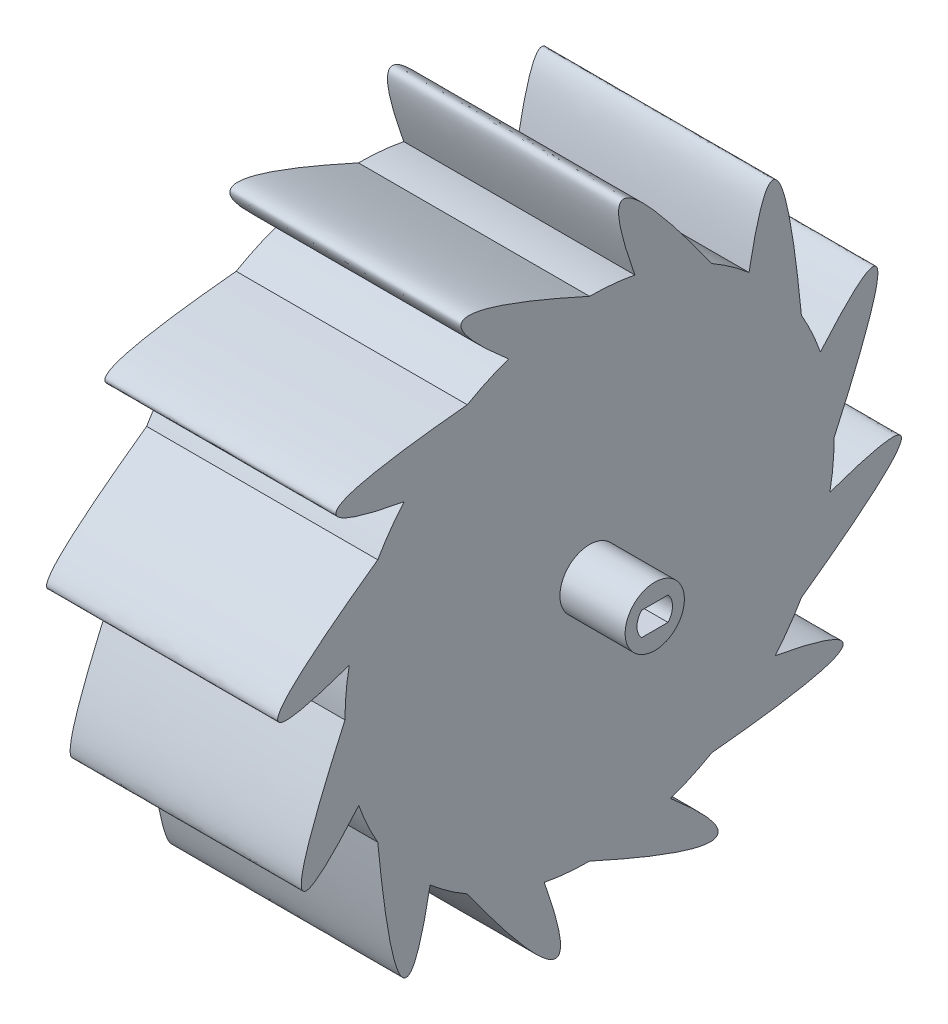
from build123d import *

# Parameters (mm, degrees)
SKETCH1_R           = 32.5
SKETCH1_R_2         = 5
BOSS_EXTRUDE1_DEPTH = 35
SKETCH2_R           = 8.5
SKETCH2_R_2         = 1
BOSS_EXTRUDE2_DEPTH = 1
SKETCH3_R           = 32.5
BOSS_EXTRUDE4_DEPTH = 2
SKETCH4_R           = 32.5
SKETCH4_R_2         = 5
BOSS_EXTRUDE5_DEPTH = 2
SKETCH5_R           = 5
BOSS_EXTRUDE6_DEPTH = 48
BOSS_EXTRUDE7_START = -39
SKETCH6_R           = 32.5
BOSS_EXTRUDE7_DEPTH = 39


with BuildPart() as part:
    # Sketch1 → Boss-Extrude1 (new body)
    with BuildSketch(Plane(origin=(0, 0, 0), x_dir=(0, 0, -1), z_dir=(1, 0, 0))):
        Circle(SKETCH1_R)
        Circle(SKETCH1_R_2, mode=Mode.SUBTRACT)
    extrude(amount=-BOSS_EXTRUDE1_DEPTH)



with BuildPart() as body_2:
    # Sketch2 → Boss-Extrude2 (new body)
    with BuildSketch(Plane.ZY.offset(35)):
        Circle(SKETCH2_R)
        Circle(SKETCH2_R_2, mode=Mode.SUBTRACT)
    extrude(amount=-BOSS_EXTRUDE2_DEPTH)


with BuildPart() as part_1:
    add(part.part)

    add(body_2.part)  # Boss-Extrude4 merges body 2
    # Sketch3 → Boss-Extrude4 (add)
    with BuildSketch(Plane.ZY.offset(35)):
        with Locations(Location((0, 0, 0), (0, 0, 180))):
            Circle(SKETCH3_R)
        with BuildLine():
            Line((12.893796958, 4), (20.615528128, 4))
            ThreePointArc((20.615528128, 4), (21, 0), (20.615528128, -4))
            Line((20.615528128, -4), (12.893796958, -4))
            ThreePointArc((12.893796958, -4), (13.5, 0), (12.893796958, 4))
        make_face(mode=Mode.SUBTRACT)
        with BuildLine():
            Line((7.788628447, -11.026661639), (10.174774605, -18.370464386))
            ThreePointArc((10.174774605, -18.370464386), (6.489356882, -19.972186842), (2.566322474, -20.842600341))
            Line((2.566322474, -20.842600341), (0.180176317, -13.498797594))
            ThreePointArc((0.180176317, -13.498797594), (4.171729424, -12.83926297), (7.788628447, -11.026661639))
        make_face(mode=Mode.SUBTRACT)
        with BuildLine():
            Line((-8.080159852, -10.814851676), (-14.327171594, -15.353571379))
            ThreePointArc((-14.327171594, -15.353571379), (-16.989356882, -12.343490298), (-19.029453613, -8.881435424))
            Line((-19.029453613, -8.881435424), (-12.78244187, -4.342715721))
            ThreePointArc((-12.78244187, -4.342715721), (-10.921729424, -7.935100906), (-8.080159852, -10.814851676))
        make_face(mode=Mode.SUBTRACT)
        with BuildLine():
            Line((-12.78244187, 4.342715721), (-19.029453613, 8.881435424))
            ThreePointArc((-19.029453613, 8.881435424), (-16.989356882, 12.343490298), (-14.327171594, 15.353571379))
            Line((-14.327171594, 15.353571379), (-8.080159852, 10.814851676))
            ThreePointArc((-8.080159852, 10.814851676), (-10.921729424, 7.935100906), (-12.78244187, 4.342715721))
        make_face(mode=Mode.SUBTRACT)
        with BuildLine():
            Line((0.180176317, 13.498797594), (2.566322474, 20.842600341))
            ThreePointArc((2.566322474, 20.842600341), (6.489356882, 19.972186842), (10.174774605, 18.370464386))
            Line((10.174774605, 18.370464386), (7.788628447, 11.026661639))
            ThreePointArc((7.788628447, 11.026661639), (4.171729424, 12.83926297), (0.180176317, 13.498797594))
        make_face(mode=Mode.SUBTRACT)
        with BuildLine():
            Line((-2.236067977, 2), (2.236067977, 2))
            ThreePointArc((2.236067977, 2), (3, 0), (2.236067977, -2))
            Line((2.236067977, -2), (-2.236067977, -2))
            ThreePointArc((-2.236067977, -2), (-3, 0), (-2.236067977, 2))
        make_face(mode=Mode.SUBTRACT)
    extrude(amount=BOSS_EXTRUDE4_DEPTH)

    # Sketch4 → Boss-Extrude5 (add)
    with BuildSketch(Plane.ZY.offset(37)):
        with Locations(Location((0, 0, 0), (0, 0, 180))):
            Circle(SKETCH4_R)
        with Locations(Location((0, 0, 0), (0, 0, 180))):
            Circle(SKETCH4_R_2, mode=Mode.SUBTRACT)
    extrude(amount=BOSS_EXTRUDE5_DEPTH)



with BuildPart() as body_2_2:
    # Sketch5 → Boss-Extrude6 (new body)
    with BuildSketch(Plane.ZY.offset(37)):
        with Locations(Location((0, 0, 0), (0, 0, 180))):
            Circle(SKETCH5_R)
        with BuildLine():
            Line((2.236067977, 2), (-2.236067977, 2))
            ThreePointArc((-2.236067977, 2), (-3, 0), (-2.236067977, -2))
            Line((-2.236067977, -2), (2.236067977, -2))
            ThreePointArc((2.236067977, -2), (3, 0), (2.236067977, 2))
        make_face(mode=Mode.SUBTRACT)
    extrude(amount=-BOSS_EXTRUDE6_DEPTH)


with BuildPart() as part_2:
    add(part_1.part)

    add(body_2_2.part)  # Boss-Extrude7 merges body 2 2
    # Sketch6 → Boss-Extrude7 (add)
    with BuildSketch(Plane.ZY.offset(39).offset(BOSS_EXTRUDE7_START)):
        with BuildLine():
            ThreePointArc((-20.63586518, 35.74236695), (-23.870874178, 33.668042606), (-26.898922548, 31.301816125))
            add(Edge.make_bspline(
                [(-35.74236695, 20.63586518), (-31.995057853, 58.772650811), (-26.898922548, 31.301816125)],
                knots=[0, 0, 0, 1, 1, 1], degree=2))
            ThreePointArc((-35.74236695, 20.63586518), (-37.506804752, 17.221943104), (-38.946058323, 13.658706674))
            add(Edge.make_bspline(
                [(-41.27173036, 0), (-57.094858301, 34.901079724), (-38.946058323, 13.658706674)],
                knots=[0, 0, 0, 1, 1, 1], degree=2))
            ThreePointArc((-41.27173036, 0), (-41.092817282, -3.838762145), (-40.557629223, -7.644242199))
            add(Edge.make_bspline(
                [(-35.74236695, -20.63586518), (-66.896137576, 1.67779251), (-40.557629223, -7.644242199)],
                knots=[0, 0, 0, 1, 1, 1], degree=2))
            ThreePointArc((-35.74236695, -20.63586518), (-33.668042606, -23.870874178), (-31.301816125, -26.898922548))
            add(Edge.make_bspline(
                [(-20.63586518, -35.74236695), (-58.772650811, -31.995057853), (-31.301816125, -26.898922548)],
                knots=[0, 0, 0, 1, 1, 1], degree=2))
            ThreePointArc((-20.63586518, -35.74236695), (-17.221943104, -37.506804752), (-13.658706674, -38.946058323))
            add(Edge.make_bspline(
                [(0, -41.27173036), (-34.901079724, -57.094858301), (-13.658706674, -38.946058323)],
                knots=[0, 0, 0, 1, 1, 1], degree=2))
            ThreePointArc((0, -41.27173036), (3.838762145, -41.092817282), (7.644242199, -40.557629223))
            add(Edge.make_bspline(
                [(20.63586518, -35.74236695), (-1.67779251, -66.896137576), (7.644242199, -40.557629223)],
                knots=[0, 0, 0, 1, 1, 1], degree=2))
            ThreePointArc((20.63586518, -35.74236695), (23.870874178, -33.668042606), (26.898922548, -31.301816125))
            add(Edge.make_bspline(
                [(35.74236695, -20.63586518), (31.995057853, -58.772650811), (26.898922548, -31.301816125)],
                knots=[0, 0, 0, 1, 1, 1], degree=2))
            ThreePointArc((35.74236695, -20.63586518), (37.506804752, -17.221943104), (38.946058323, -13.658706674))
            add(Edge.make_bspline(
                [(41.27173036, 0), (57.094858301, -34.901079724), (38.946058323, -13.658706674)],
                knots=[0, 0, 0, 1, 1, 1], degree=2))
            ThreePointArc((41.27173036, 0), (41.092817282, 3.838762145), (40.557629223, 7.644242199))
            add(Edge.make_bspline(
                [(35.74236695, 20.63586518), (66.896137576, -1.67779251), (40.557629223, 7.644242199)],
                knots=[0, 0, 0, 1, 1, 1], degree=2))
            ThreePointArc((35.74236695, 20.63586518), (33.668042606, 23.870874178), (31.301816125, 26.898922548))
            add(Edge.make_bspline(
                [(20.63586518, 35.74236695), (58.772650811, 31.995057853), (31.301816125, 26.898922548)],
                knots=[0, 0, 0, 1, 1, 1], degree=2))
            ThreePointArc((20.63586518, 35.74236695), (17.221943104, 37.506804752), (13.658706674, 38.946058323))
            add(Edge.make_bspline(
                [(0, 41.27173036), (34.901079724, 57.094858301), (13.658706674, 38.946058323)],
                knots=[0, 0, 0, 1, 1, 1], degree=2))
            ThreePointArc((0, 41.27173036), (-3.838762145, 41.092817282), (-7.644242199, 40.557629223))
            add(Edge.make_bspline(
                [(-20.63586518, 35.74236695), (1.67779251, 66.896137576), (-7.644242199, 40.557629223)],
                knots=[0, 0, 0, 1, 1, 1], degree=2))
        make_face()
        Circle(SKETCH6_R, mode=Mode.SUBTRACT)
    extrude(amount=BOSS_EXTRUDE7_DEPTH)


solid = part_2.part
